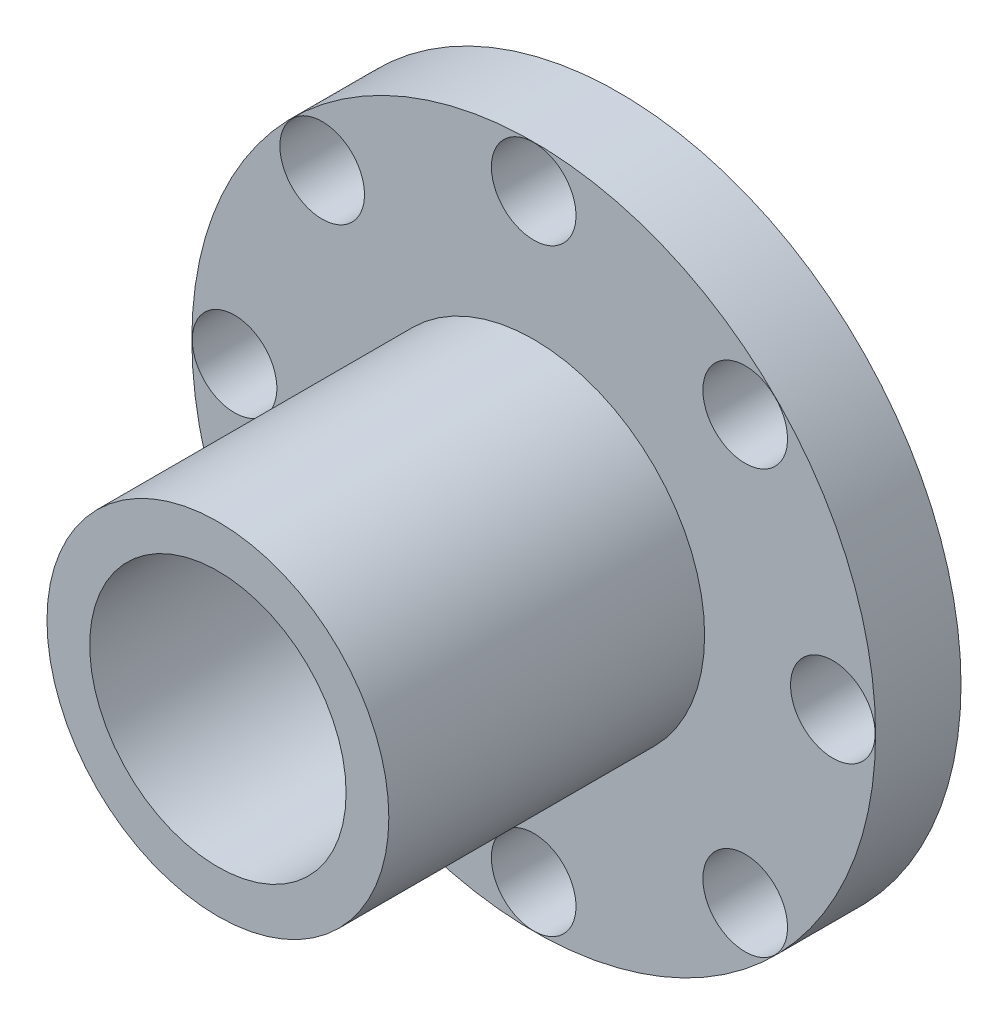
from build123d import *

# Parameters (mm, degrees)
SKETCH_1_R          = 4
EXTRUDE_1_DEPTH     = 9.39
SKETCH_2_R          = 3
CUT_EXTRUDE_1_DEPTH = 8
CUT_EXTRUDE_START   = -8
SKETCH_3_R          = 3
CUT_EXTRUDE_3_DEPTH = 8
SKETCH_4_R          = 8
SKETCH_4_R_2        = 4
EXTRUDE_4_DEPTH     = 2
SKETCH_5_R          = 0.99
CUT_EXTRUDE_6_DEPTH = 2


with BuildPart() as part:
    # 草图1 → 凸台-拉伸1 (new body)
    with BuildSketch(Plane.XY):
        Circle(SKETCH_1_R)
    extrude(amount=EXTRUDE_1_DEPTH)

    # 草图2 → 切除-拉伸1 (cut)
    with BuildSketch(Plane.XY.offset(9.39)):
        Circle(SKETCH_2_R)
    extrude(amount=-CUT_EXTRUDE_1_DEPTH, mode=Mode.SUBTRACT)

    # 草图3 → 切除-拉伸3 (cut)
    with BuildSketch(Plane(origin=(0, 0, 0), x_dir=(-1, 0, 0), z_dir=(0, 0, -1)).offset(CUT_EXTRUDE_START)):
        with Locations(Location((0, 0, 0), (0, 0, 180))):
            Circle(SKETCH_3_R)
    extrude(amount=CUT_EXTRUDE_3_DEPTH, mode=Mode.SUBTRACT)

    # 草图4 → 凸台-拉伸4 (add)
    with BuildSketch(Plane(origin=(0, 0, 0), x_dir=(-1, 0, 0), z_dir=(0, 0, -1))):
        Circle(SKETCH_4_R)
        Circle(SKETCH_4_R_2, mode=Mode.SUBTRACT)
    extrude(amount=-EXTRUDE_4_DEPTH)

    # 草图5 → 切除-拉伸6 (cut)
    with BuildSketch(Plane(origin=(0, 0, 0), x_dir=(-1, 0, 0), z_dir=(0, 0, -1))):
        with Locations((7, 0)):
            Circle(SKETCH_5_R)
        with Locations((4.949747468, -4.949747468)):
            Circle(SKETCH_5_R)
        with Locations((0, -7)):
            Circle(SKETCH_5_R)
        with Locations((-4.949747468, -4.949747468)):
            Circle(SKETCH_5_R)
        with Locations((-7, 0)):
            Circle(SKETCH_5_R)
        with Locations((-4.949747468, 4.949747468)):
            Circle(SKETCH_5_R)
        with Locations((0, 7)):
            Circle(SKETCH_5_R)
        with Locations((4.949747468, 4.949747468)):
            Circle(SKETCH_5_R)
    extrude(amount=-CUT_EXTRUDE_6_DEPTH, mode=Mode.SUBTRACT)


solid = part.part
